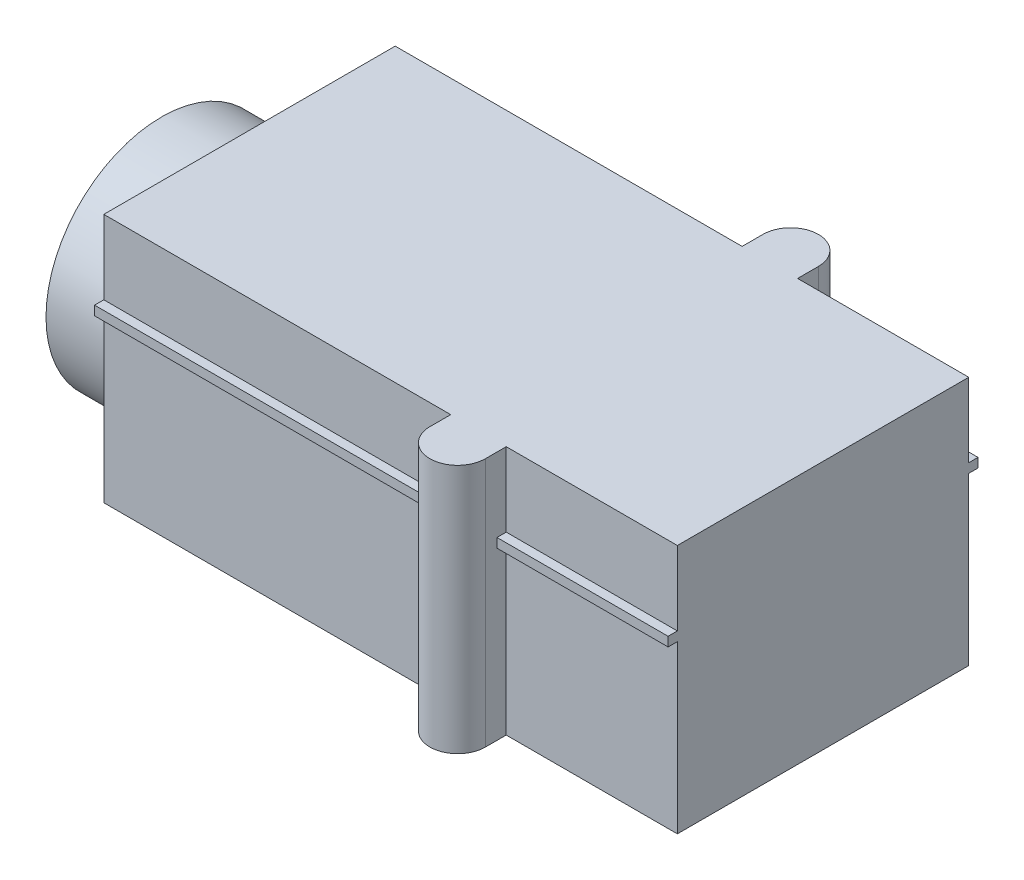
from build123d import *

# Parameters (mm, degrees)
BOSS_EXTRUDE1_DEPTH = 5.4
SKETCH2_R           = 2.5
BOSS_EXTRUDE2_DEPTH = 1.9
SKETCH3_W           = 12.4
SKETCH3_H           = 6.7
BOSS_EXTRUDE3_DEPTH = 0.2


with BuildPart() as part:
    # Sketch1 → Boss-Extrude1 (new body)
    with BuildSketch(Plane(origin=(0, 0, 0), x_dir=(1, 0, 0), z_dir=(0, 1, 0))):
        with BuildLine():
            Line((0, -3.15), (0, 3.15))
            Line((0, 3.15), (7.5, 3.15))
            Line((7.5, 3.15), (7.5, 3.6))
            ThreePointArc((7.5, 3.6), (8.1, 4.2), (8.7, 3.6))
            Line((8.7, 3.6), (8.7, 3.15))
            Line((8.7, 3.15), (12.4, 3.15))
            Line((12.4, 3.15), (12.4, -3.15))
            Line((12.4, -3.15), (8.7, -3.15))
            Line((8.7, -3.15), (8.7, -3.6))
            ThreePointArc((8.7, -3.6), (8.1, -4.2), (7.5, -3.6))
            Line((7.5, -3.6), (7.5, -3.15))
            Line((7.5, -3.15), (0, -3.15))
        make_face()
    extrude(amount=BOSS_EXTRUDE1_DEPTH)

    # Sketch2 → Boss-Extrude2 (add)
    with BuildSketch(Plane.ZY):
        with Locations(Location((0, 2.2, 0), (0, 0, 241.642363424))):
            Circle(SKETCH2_R)
    extrude(amount=BOSS_EXTRUDE2_DEPTH)

    # Sketch3 → Boss-Extrude3 (add)
    with BuildSketch(Plane(origin=(0, 3.6, 0), x_dir=(-1, 0, 0), z_dir=(0, -1, 0))):
        with Locations((-6.2, 0)):
            Rectangle(SKETCH3_W, SKETCH3_H)
    extrude(amount=-BOSS_EXTRUDE3_DEPTH)


solid = part.part
